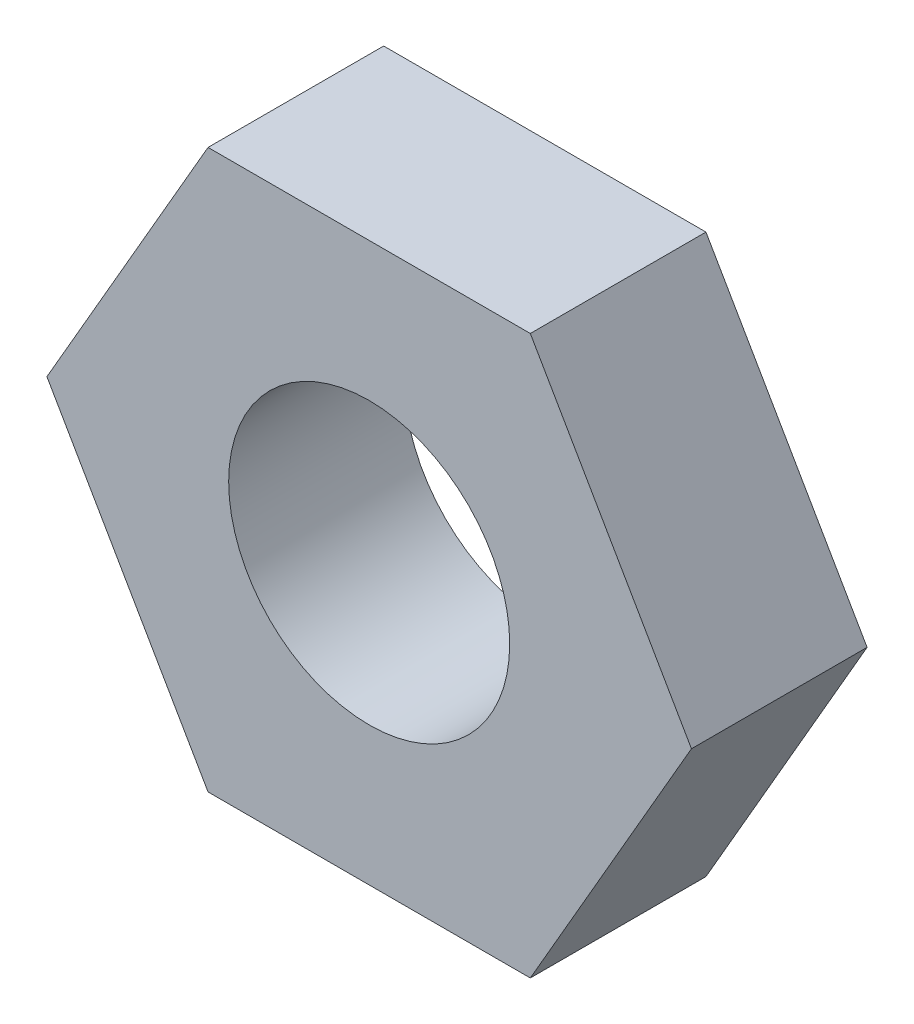
from build123d import *

# Parameters (mm, degrees)
SKETCH1_R           = 4
BOSS_EXTRUDE1_DEPTH = 5


with BuildPart() as part:
    # Sketch1 → Boss-Extrude1 (new body)
    with BuildSketch(Plane.XY):
        Polygon((-4.587047889, 7.945), (-6.880571833, 3.9725), (-9.174095777, 0), (-6.880571833, -3.9725), (-4.587047889, -7.945), (0, -7.945), (4.587047889, -7.945), (6.880571833, -3.9725), (9.174095777, 0), (6.880571833, 3.9725), (4.587047889, 7.945), (0, 7.945), align=None)
        Circle(SKETCH1_R, mode=Mode.SUBTRACT)
    extrude(amount=BOSS_EXTRUDE1_DEPTH)


solid = part.part
